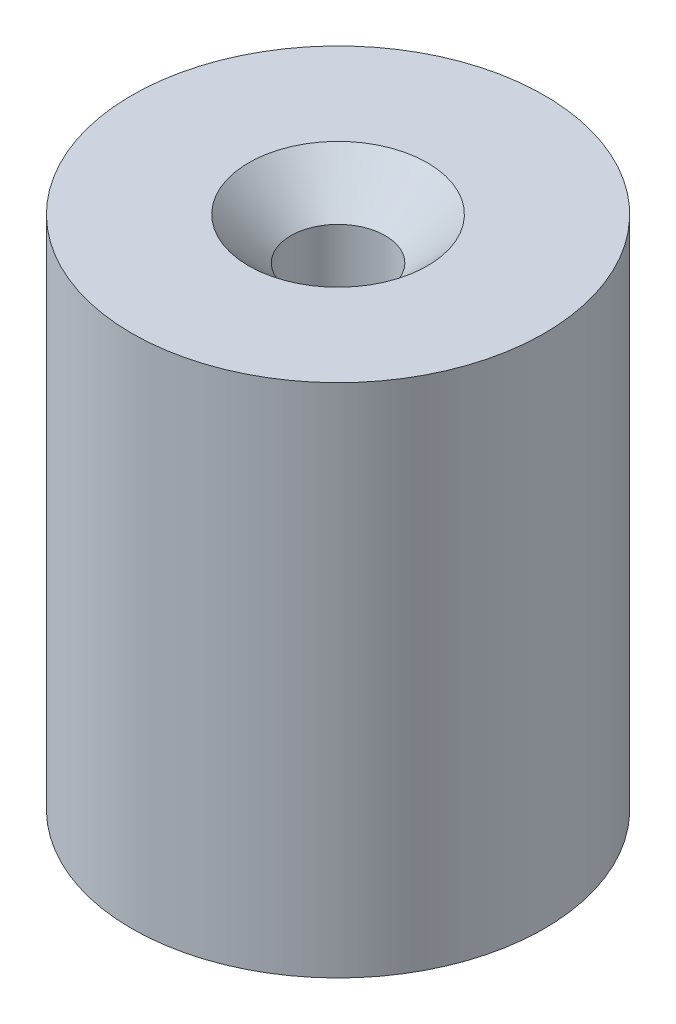
from build123d import *

# Parameters (mm, degrees)
SKETCH1_R                                           = 12
BOSS_EXTRUDE1_DEPTH                                 = 30
CSK_FOR_M5_COUNTERSUNK_FLAT_HEAD_SCREW1_D           = 5.5
CSK_FOR_M5_COUNTERSUNK_FLAT_HEAD_SCREW1_DEPTH       = 12
CSK_FOR_M5_COUNTERSUNK_FLAT_HEAD_SCREW1_CSINK_D     = 10.4
CSK_FOR_M5_COUNTERSUNK_FLAT_HEAD_SCREW1_CSINK_ANGLE = 90
CSK_FOR_M5_COUNTERSUNK_FLAT_HEAD_SCREW1_TIP         = 1.652366702
F_8_0MM_DOWEL_HOLE1_D                               = 8
F_8_0MM_DOWEL_HOLE1_DEPTH                           = 12
F_8_0MM_DOWEL_HOLE1_TIP                             = 2.403442476


with BuildPart() as part:
    # Sketch1 → Boss-Extrude1 (new body)
    with BuildSketch(Plane(origin=(0, 0, 0), x_dir=(1, 0, 0), z_dir=(0, 1, 0))):
        with Locations(Location((0, 0, 0), (0, 0, 270))):
            Circle(SKETCH1_R)
    extrude(amount=BOSS_EXTRUDE1_DEPTH)

    # CSK for M5 Countersunk Flat Head Screw1
    with Locations(Plane(origin=(0, 30, 0), x_dir=(1, 0, 0), z_dir=(0, 1, 0))):
        with Locations((0, 0)):
            CounterSinkHole(CSK_FOR_M5_COUNTERSUNK_FLAT_HEAD_SCREW1_D / 2, CSK_FOR_M5_COUNTERSUNK_FLAT_HEAD_SCREW1_CSINK_D / 2, depth=CSK_FOR_M5_COUNTERSUNK_FLAT_HEAD_SCREW1_DEPTH, counter_sink_angle=CSK_FOR_M5_COUNTERSUNK_FLAT_HEAD_SCREW1_CSINK_ANGLE)
            with Locations((0, 0, -(CSK_FOR_M5_COUNTERSUNK_FLAT_HEAD_SCREW1_DEPTH + CSK_FOR_M5_COUNTERSUNK_FLAT_HEAD_SCREW1_TIP / 2))):  # 118° drill point
                Cone(0, CSK_FOR_M5_COUNTERSUNK_FLAT_HEAD_SCREW1_D / 2, CSK_FOR_M5_COUNTERSUNK_FLAT_HEAD_SCREW1_TIP, mode=Mode.SUBTRACT)

    # Ø8.0mm Dowel Hole1
    with Locations(Plane(origin=(0, 0, 0), x_dir=(-1, 0, 0), z_dir=(0, -1, 0))):
        with Locations((0, 0)):
            Hole(F_8_0MM_DOWEL_HOLE1_D / 2, depth=F_8_0MM_DOWEL_HOLE1_DEPTH)
            with Locations((0, 0, -(F_8_0MM_DOWEL_HOLE1_DEPTH + F_8_0MM_DOWEL_HOLE1_TIP / 2))):  # 118° drill point
                Cone(0, F_8_0MM_DOWEL_HOLE1_D / 2, F_8_0MM_DOWEL_HOLE1_TIP, mode=Mode.SUBTRACT)


solid = part.part
